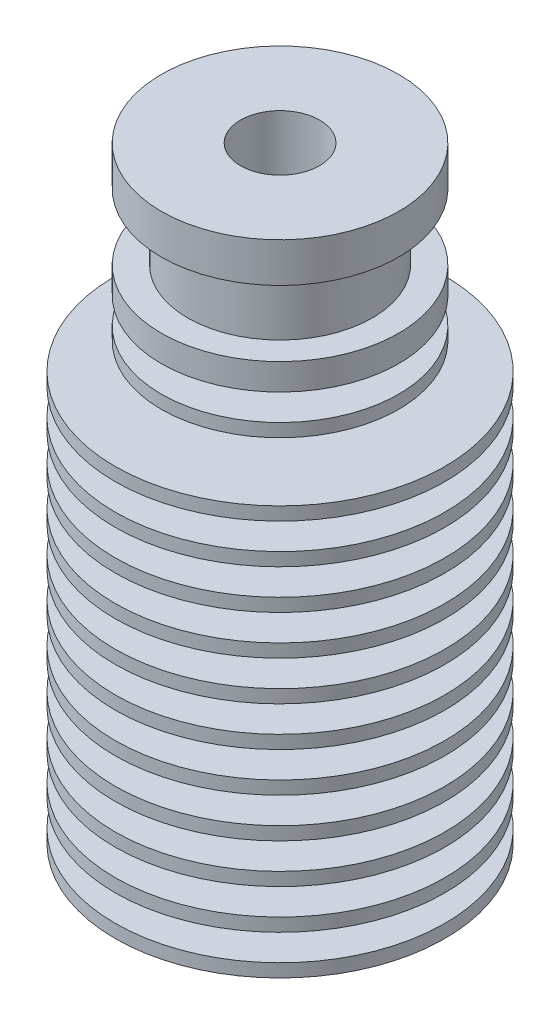
from build123d import *

# Parameters (mm, degrees)
SKETCH_1_R          = 12.5
EXTRUDE_1_DEPTH     = 1
SKETCH_5_R          = 4
EXTRUDE_4_DEPTH     = 2
SKETCH_6_R          = 12.5
EXTRUDE_5_DEPTH     = 1
SKETCH_7_R          = 4
EXTRUDE_6_DEPTH     = 2
SKETCH_8_R          = 12.5
EXTRUDE_7_DEPTH     = 1
SKETCH_9_R          = 4
EXTRUDE_8_DEPTH     = 2
SKETCH_10_R         = 12.5
EXTRUDE_9_DEPTH     = 1
SKETCH_11_R         = 4
EXTRUDE_10_DEPTH    = 2
SKETCH_12_R         = 12.5
EXTRUDE_11_DEPTH    = 1
SKETCH_13_R         = 4
EXTRUDE_12_DEPTH    = 2
SKETCH_14_R         = 12.5
EXTRUDE_13_DEPTH    = 1
SKETCH_15_R         = 4
EXTRUDE_14_DEPTH    = 2
SKETCH_16_R         = 12.5
EXTRUDE_15_DEPTH    = 1
SKETCH_17_R         = 4
EXTRUDE_16_DEPTH    = 2
SKETCH_18_R         = 12.5
EXTRUDE_17_DEPTH    = 1
SKETCH_19_R         = 4
EXTRUDE_18_DEPTH    = 2
SKETCH_20_R         = 12.5
EXTRUDE_19_DEPTH    = 1
SKETCH_21_R         = 4
EXTRUDE_20_DEPTH    = 2
SKETCH_22_R         = 12.5
EXTRUDE_21_DEPTH    = 1
SKETCH_23_R         = 4
EXTRUDE_22_DEPTH    = 2
SKETCH_24_R         = 12.5
EXTRUDE_23_DEPTH    = 1
SKETCH_25_R         = 4
EXTRUDE_24_DEPTH    = 2
SKETCH_26_R         = 9
EXTRUDE_25_DEPTH    = 1
SKETCH_27_R         = 4
EXTRUDE_26_DEPTH    = 2
SKETCH_28_R         = 9
EXTRUDE_27_DEPTH    = 2
SKETCH_29_R         = 7
EXTRUDE_28_DEPTH    = 5
SKETCH_30_R         = 9
EXTRUDE_29_DEPTH    = 3
SKETCH_31_R         = 3
CUT_EXTRUDE_1_DEPTH = 50.279813311


with BuildPart() as part:
    # 草图1 → 凸台-拉伸1 (new body)
    with BuildSketch(Plane(origin=(0, 0, 0), x_dir=(1, 0, 0), z_dir=(0, 1, 0))):
        with Locations(Location((0, 0, 0), (0, 0, 270))):
            Circle(SKETCH_1_R)
    extrude(amount=EXTRUDE_1_DEPTH)

    # 草图5 → 凸台-拉伸4 (add)
    with BuildSketch(Plane(origin=(0, 1, 0), x_dir=(1, 0, 0), z_dir=(0, 1, 0))):
        with Locations(Location((0, 0, 0), (0, 0, 270))):
            Circle(SKETCH_5_R)
    extrude(amount=EXTRUDE_4_DEPTH)

    # 草图6 → 凸台-拉伸5 (add)
    with BuildSketch(Plane(origin=(0, 3, 0), x_dir=(1, 0, 0), z_dir=(0, 1, 0))):
        with Locations(Location((0, 0, 0), (0, 0, 270))):
            Circle(SKETCH_6_R)
    extrude(amount=EXTRUDE_5_DEPTH)

    # 草图7 → 凸台-拉伸6 (add)
    with BuildSketch(Plane(origin=(0, 4, 0), x_dir=(1, 0, 0), z_dir=(0, 1, 0))):
        with Locations(Location((0, 0, 0), (0, 0, 270))):
            Circle(SKETCH_7_R)
    extrude(amount=EXTRUDE_6_DEPTH)

    # 草图8 → 凸台-拉伸7 (add)
    with BuildSketch(Plane(origin=(0, 6, 0), x_dir=(1, 0, 0), z_dir=(0, 1, 0))):
        with Locations(Location((0, 0, 0), (0, 0, 270))):
            Circle(SKETCH_8_R)
    extrude(amount=EXTRUDE_7_DEPTH)

    # 草图9 → 凸台-拉伸8 (add)
    with BuildSketch(Plane(origin=(0, 7, 0), x_dir=(1, 0, 0), z_dir=(0, 1, 0))):
        with Locations(Location((0, 0, 0), (0, 0, 270))):
            Circle(SKETCH_9_R)
    extrude(amount=EXTRUDE_8_DEPTH)

    # 草图10 → 凸台-拉伸9 (add)
    with BuildSketch(Plane(origin=(0, 9, 0), x_dir=(1, 0, 0), z_dir=(0, 1, 0))):
        with Locations(Location((0, 0, 0), (0, 0, 270))):
            Circle(SKETCH_10_R)
    extrude(amount=EXTRUDE_9_DEPTH)

    # 草图11 → 凸台-拉伸10 (add)
    with BuildSketch(Plane(origin=(0, 10, 0), x_dir=(1, 0, 0), z_dir=(0, 1, 0))):
        with Locations(Location((0, 0, 0), (0, 0, 270))):
            Circle(SKETCH_11_R)
    extrude(amount=EXTRUDE_10_DEPTH)

    # 草图12 → 凸台-拉伸11 (add)
    with BuildSketch(Plane(origin=(0, 12, 0), x_dir=(1, 0, 0), z_dir=(0, 1, 0))):
        with Locations(Location((0, 0, 0), (0, 0, 270))):
            Circle(SKETCH_12_R)
    extrude(amount=EXTRUDE_11_DEPTH)

    # 草图13 → 凸台-拉伸12 (add)
    with BuildSketch(Plane(origin=(0, 13, 0), x_dir=(1, 0, 0), z_dir=(0, 1, 0))):
        with Locations(Location((0, 0, 0), (0, 0, 270))):
            Circle(SKETCH_13_R)
    extrude(amount=EXTRUDE_12_DEPTH)

    # 草图14 → 凸台-拉伸13 (add)
    with BuildSketch(Plane(origin=(0, 15, 0), x_dir=(1, 0, 0), z_dir=(0, 1, 0))):
        with Locations(Location((0, 0, 0), (0, 0, 270))):
            Circle(SKETCH_14_R)
    extrude(amount=EXTRUDE_13_DEPTH)

    # 草图15 → 凸台-拉伸14 (add)
    with BuildSketch(Plane(origin=(0, 16, 0), x_dir=(1, 0, 0), z_dir=(0, 1, 0))):
        with Locations(Location((0, 0, 0), (0, 0, 270))):
            Circle(SKETCH_15_R)
    extrude(amount=EXTRUDE_14_DEPTH)

    # 草图16 → 凸台-拉伸15 (add)
    with BuildSketch(Plane(origin=(0, 18, 0), x_dir=(1, 0, 0), z_dir=(0, 1, 0))):
        with Locations(Location((0, 0, 0), (0, 0, 270))):
            Circle(SKETCH_16_R)
    extrude(amount=EXTRUDE_15_DEPTH)

    # 草图17 → 凸台-拉伸16 (add)
    with BuildSketch(Plane(origin=(0, 19, 0), x_dir=(1, 0, 0), z_dir=(0, 1, 0))):
        with Locations(Location((0, 0, 0), (0, 0, 270))):
            Circle(SKETCH_17_R)
    extrude(amount=EXTRUDE_16_DEPTH)

    # 草图18 → 凸台-拉伸17 (add)
    with BuildSketch(Plane(origin=(0, 21, 0), x_dir=(1, 0, 0), z_dir=(0, 1, 0))):
        with Locations(Location((0, 0, 0), (0, 0, 270))):
            Circle(SKETCH_18_R)
    extrude(amount=EXTRUDE_17_DEPTH)

    # 草图19 → 凸台-拉伸18 (add)
    with BuildSketch(Plane(origin=(0, 22, 0), x_dir=(1, 0, 0), z_dir=(0, 1, 0))):
        with Locations(Location((0, 0, 0), (0, 0, 270))):
            Circle(SKETCH_19_R)
    extrude(amount=EXTRUDE_18_DEPTH)

    # 草图20 → 凸台-拉伸19 (add)
    with BuildSketch(Plane(origin=(0, 24, 0), x_dir=(1, 0, 0), z_dir=(0, 1, 0))):
        with Locations(Location((0, 0, 0), (0, 0, 270))):
            Circle(SKETCH_20_R)
    extrude(amount=EXTRUDE_19_DEPTH)

    # 草图21 → 凸台-拉伸20 (add)
    with BuildSketch(Plane(origin=(0, 25, 0), x_dir=(1, 0, 0), z_dir=(0, 1, 0))):
        with Locations(Location((0, 0, 0), (0, 0, 270))):
            Circle(SKETCH_21_R)
    extrude(amount=EXTRUDE_20_DEPTH)

    # 草图22 → 凸台-拉伸21 (add)
    with BuildSketch(Plane(origin=(0, 27, 0), x_dir=(1, 0, 0), z_dir=(0, 1, 0))):
        with Locations(Location((0, 0, 0), (0, 0, 270))):
            Circle(SKETCH_22_R)
    extrude(amount=EXTRUDE_21_DEPTH)

    # 草图23 → 凸台-拉伸22 (add)
    with BuildSketch(Plane(origin=(0, 28, 0), x_dir=(1, 0, 0), z_dir=(0, 1, 0))):
        with Locations(Location((0, 0, 0), (0, 0, 270))):
            Circle(SKETCH_23_R)
    extrude(amount=EXTRUDE_22_DEPTH)

    # 草图24 → 凸台-拉伸23 (add)
    with BuildSketch(Plane(origin=(0, 30, 0), x_dir=(1, 0, 0), z_dir=(0, 1, 0))):
        with Locations(Location((0, 0, 0), (0, 0, 270))):
            Circle(SKETCH_24_R)
    extrude(amount=EXTRUDE_23_DEPTH)

    # 草图25 → 凸台-拉伸24 (add)
    with BuildSketch(Plane(origin=(0, 31, 0), x_dir=(1, 0, 0), z_dir=(0, 1, 0))):
        with Locations(Location((0, 0, 0), (0, 0, 270))):
            Circle(SKETCH_25_R)
    extrude(amount=EXTRUDE_24_DEPTH)

    # 草图26 → 凸台-拉伸25 (add)
    with BuildSketch(Plane(origin=(0, 33, 0), x_dir=(1, 0, 0), z_dir=(0, 1, 0))):
        with Locations(Location((0, 0, 0), (0, 0, 270))):
            Circle(SKETCH_26_R)
    extrude(amount=EXTRUDE_25_DEPTH)

    # 草图27 → 凸台-拉伸26 (add)
    with BuildSketch(Plane(origin=(0, 34, 0), x_dir=(1, 0, 0), z_dir=(0, 1, 0))):
        with Locations(Location((0, 0, 0), (0, 0, 270))):
            Circle(SKETCH_27_R)
    extrude(amount=EXTRUDE_26_DEPTH)

    # 草图28 → 凸台-拉伸27 (add)
    with BuildSketch(Plane(origin=(0, 36, 0), x_dir=(1, 0, 0), z_dir=(0, 1, 0))):
        with Locations(Location((0, 0, 0), (0, 0, 270))):
            Circle(SKETCH_28_R)
    extrude(amount=EXTRUDE_27_DEPTH)

    # 草图29 → 凸台-拉伸28 (add)
    with BuildSketch(Plane(origin=(0, 38, 0), x_dir=(1, 0, 0), z_dir=(0, 1, 0))):
        with Locations(Location((0, 0, 0), (0, 0, 270))):
            Circle(SKETCH_29_R)
    extrude(amount=EXTRUDE_28_DEPTH)

    # 草图30 → 凸台-拉伸29 (add)
    with BuildSketch(Plane(origin=(0, 43, 0), x_dir=(1, 0, 0), z_dir=(0, 1, 0))):
        with Locations(Location((0, 0, 0), (0, 0, 270))):
            Circle(SKETCH_30_R)
    extrude(amount=EXTRUDE_29_DEPTH)

    # 草图31 → 切除-拉伸1 (cut, through all)
    with BuildSketch(Plane(origin=(0, 0, 0), x_dir=(-1, 0, 0), z_dir=(0, -1, 0))):
        with Locations(Location((0, 0, 0), (0, 0, 90))):
            Circle(SKETCH_31_R)
    extrude(amount=-CUT_EXTRUDE_1_DEPTH, mode=Mode.SUBTRACT)


solid = part.part
